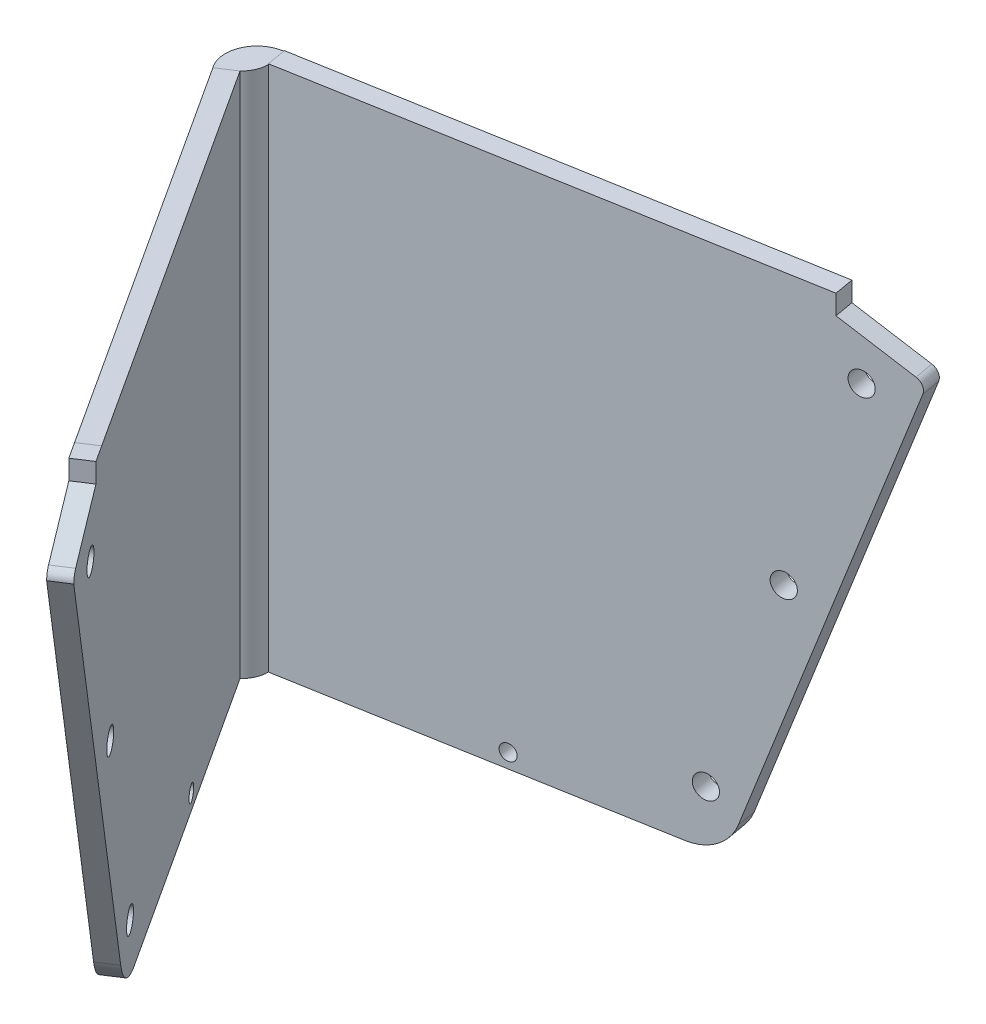
from build123d import *

# Parameters (mm, degrees)
SKETCH1_R           = 0.6
SKETCH1_R_2         = 0.4
BOSS_EXTRUDE2_DEPTH = 1
BOSS_EXTRUDE3_DEPTH = 26.85
SKETCH3_R           = 0.6
SKETCH3_R_2         = 0.4
BOSS_EXTRUDE4_DEPTH = 1


with BuildPart() as part:
    # Sketch1 → Boss-Extrude2 (new body)
    with BuildSketch(Plane(origin=(3.159090075, 0, 17.916090109), x_dir=(-0.9848077530122081, 0, 0.17364817766693075), z_dir=(-0.17364817766693075, 0, -0.9848077530122081))):
        with BuildLine():
            Line((72.595007279, -13.558180283), (90.945658345, -13.558180283))
            Line((90.945658345, -13.558180283), (90.945658345, -12.058180283))
            Line((90.945658345, -12.058180283), (90.945658345, 13.327413467))
            Line((90.945658345, 13.327413467), (66.945658345, 13.327413467))
            Line((66.945658345, 13.327413467), (65.945658345, 13.327413467))
            Line((65.945658345, 13.327413467), (65.945658345, 12.327413467))
            Line((65.945658345, 12.327413467), (62.421811017, 11.044837929))
            ThreePointArc((62.421811017, 11.044837929), (62.139667195, 10.78630075), (62.122974779, 10.403981547))
            Line((62.122974779, 10.403981547), (70.245775727, -11.913230641))
            ThreePointArc((70.245775727, -11.913230641), (71.161066188, -13.106060393), (72.595007279, -13.558180283))
        make_face()
        with Locations((71.67696085, -10.802896266)):
            Circle(SKETCH1_R, mode=Mode.SUBTRACT)
        with Locations((68.24645728, -0.507107991)):
            Circle(SKETCH1_R, mode=Mode.SUBTRACT)
        with Locations((80.389671463, -12.820376082)):
            Circle(SKETCH1_R_2, mode=Mode.SUBTRACT)
        with Locations((64.81595371, 9.788680284)):
            Circle(SKETCH1_R, mode=Mode.SUBTRACT)
    extrude(amount=BOSS_EXTRUDE2_DEPTH)


with BuildPart() as body_2:
    # Sketch2 → Boss-Extrude3 (new body)
    with BuildSketch(Plane(origin=(0, -13.558180283, 0), x_dir=(-1, 0, 0), z_dir=(0, -1, 0))):
        with BuildLine():
            Line((86.404899366, -33.708637947), (86.404899366, -32.708637947))
            ThreePointArc((86.404899366, -32.708637947), (87.857024455, -33.679090764), (87.576421786, -35.402955053))
            Line((87.576421786, -35.402955053), (86.845068084, -34.720956693))
            ThreePointArc((86.845068084, -34.720956693), (86.519702424, -34.260574933), (86.404899366, -33.708637947))
        make_face()
    extrude(amount=-BOSS_EXTRUDE3_DEPTH)

    # Sketch3 → Boss-Extrude4 (add)
    with BuildSketch(Plane(origin=(-76.943655908, 0, 49.967794395), x_dir=(0.5446390350150253, 0, 0.8386705679454252), z_dir=(-0.8386705679454252, 0, 0.5446390350150253))):
        with BuildLine():
            Line((-18.179769608, -13.558180283), (0.170881459, -13.558180283))
            ThreePointArc((0.170881459, -13.558180283), (1.604822549, -13.106060393), (2.520113011, -11.913230641))
            Line((2.520113011, -11.913230641), (10.673067649, 10.574991619))
            ThreePointArc((10.673067649, 10.574991619), (10.582643671, 10.861779837), (10.34407772, 11.044837929))
            Line((10.34407772, 11.044837929), (6.820230392, 12.327413467))
            Line((6.820230392, 12.327413467), (6.820230392, 13.327413467))
            Line((6.820230392, 13.327413467), (5.820230392, 13.327413467))
            Line((5.820230392, 13.327413467), (-18.179769608, 13.291819717))
            Line((-18.179769608, 13.291819717), (-18.179769608, -13.558180283))
        make_face()
        with Locations((4.338937547, -0.724877435)):
            Circle(SKETCH3_R, mode=Mode.SUBTRACT)
        with Locations((7.769441116, 9.57091084)):
            Circle(SKETCH3_R, mode=Mode.SUBTRACT)
        with Locations((0.908433977, -11.02066571)):
            Circle(SKETCH3_R, mode=Mode.SUBTRACT)
        with Locations((-9.737882362, -12.779880795)):
            Circle(SKETCH3_R_2, mode=Mode.SUBTRACT)
    extrude(amount=BOSS_EXTRUDE4_DEPTH)


solid = Compound([part.part, body_2.part])
